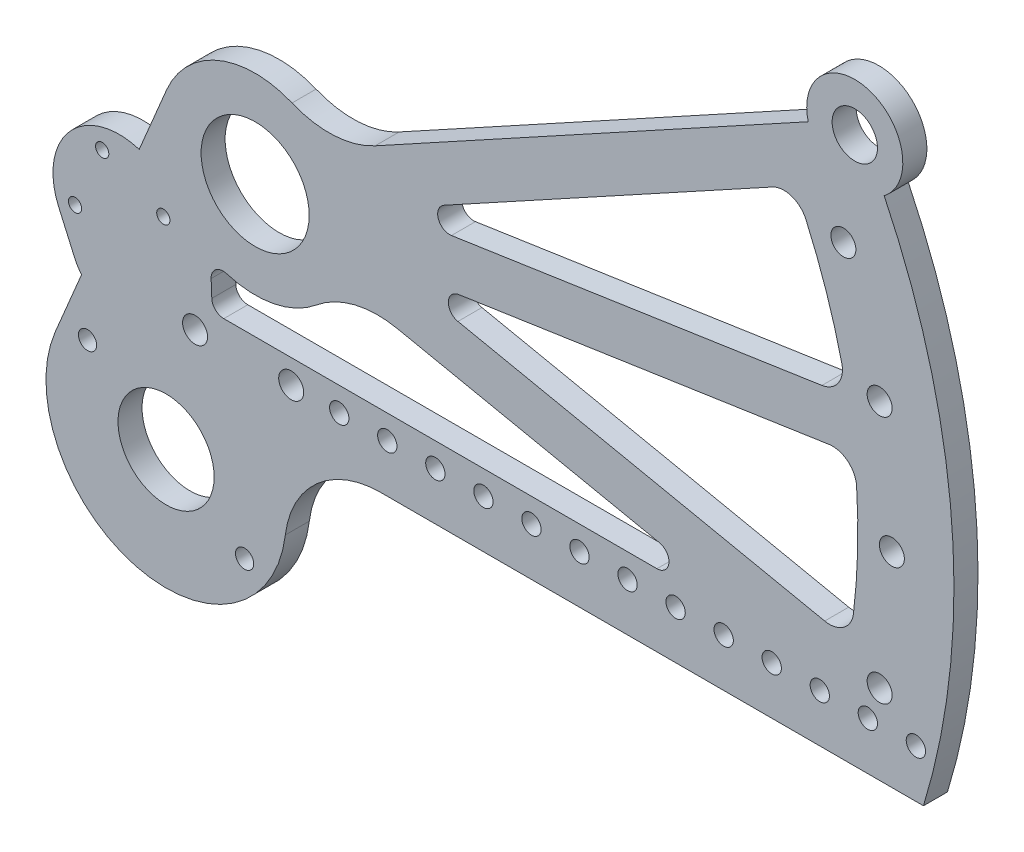
from build123d import *

# Parameters (mm, degrees)
SKETCH1_R           = 1.75
SKETCH1_R_2         = 3.302
SKETCH1_R_3         = 2.413
SKETCH1_R_4         = 12.7
SKETCH1_R_5         = 14.281149998
SKETCH1_R_6         = 2.5527
SKETCH1_R_7         = 5.9944
BOSS_EXTRUDE1_DEPTH = 6.35


with BuildPart() as part:
    # Sketch1 → Boss-Extrude1 (new body)
    with BuildSketch(Plane(origin=(0, 0, 0), x_dir=(-1, 0, 0), z_dir=(0, 0, -1))):
        with BuildLine():
            Line((-31.721738277, 24.629886735), (-146.170088384, 87.365400413))
            ThreePointArc((-146.170088384, 87.365400413), (-162.606044593, 102.518063532), (-166.242121917, 80.460801739))
            ThreePointArc((-166.242121917, 80.460801739), (-184.141380672, 14.224473287), (-176.626960261, -53.975))
            Line((-176.626960261, -53.975), (-33.194381935, -53.975))
            ThreePointArc((-33.194381935, -53.975), (-16.353189451, -60.360946363), (-7.980260895, -76.307737346))
            ThreePointArc((-7.980260895, -76.307737346), (31.676825474, -103.162616273), (52.812443226, -60.184078795))
            Line((52.812443226, -60.184078795), (45.859161931, -43.620642669))
            ThreePointArc((45.859161931, -43.620642669), (46.821980785, -42.387435085), (47.569931866, -41.013247954))
            Line((47.569931866, -41.013247954), (51.934565947, -31.139666326))
            ThreePointArc((51.934565947, -31.139666326), (48.962006062, -12.385946654), (30.645740354, -7.380696976))
            Line((30.645740354, -7.380696976), (23.420042255, 9.831664186))
            ThreePointArc((23.420042255, 9.831664186), (9.646239085, 23.497022608), (-9.756276385, 23.451547307))
            ThreePointArc((-9.756276385, 23.451547307), (-20.873181942, 21.53956394), (-31.721738277, 24.629886735))
        make_face()
        with Locations(Location((40.421189912, -12.399445261, 0), (0, 0, 180))):
            Circle(SKETCH1_R, mode=Mode.SUBTRACT)
        with Locations(Location((47.593474649, -28.556744901, 0), (0, 0, 180))):
            Circle(SKETCH1_R, mode=Mode.SUBTRACT)
        with Locations(Location((15.875, -41.275, 0), (0, 0, 180))):
            Circle(SKETCH1_R_2, mode=Mode.SUBTRACT)
        with Locations(Location((2.78154477, -87.114522117, 0), (0, 0, 180))):
            Circle(SKETCH1_R_3, mode=Mode.SUBTRACT)
        with Locations(Location((44.293236039, -57.832795939, 0), (0, 0, 180))):
            Circle(SKETCH1_R_3, mode=Mode.SUBTRACT)
        with Locations(Location((23.537390405, -72.473659028, 0), (0, 0, 180))):
            Circle(SKETCH1_R_4, mode=Mode.SUBTRACT)
        with Locations(Location((-9.525, -41.275, 0), (0, 0, 180))):
            Circle(SKETCH1_R_2, mode=Mode.SUBTRACT)
        with Locations(Location((-165.041643061, 32.828823937, 0), (0, 0, 180))):
            Circle(SKETCH1_R_2, mode=Mode.SUBTRACT)
        with Locations(Location((-165.041643061, -32.828823938, 0), (0, 0, 180))):
            Circle(SKETCH1_R_2, mode=Mode.SUBTRACT)
        with Locations(Location((-155.465828334, 64.396054582, 0), (0, 0, 180))):
            Circle(SKETCH1_R_2, mode=Mode.SUBTRACT)
        with Locations(Location((-168.275000002, -1e-09, 0), (0, 0, 180))):
            Circle(SKETCH1_R_2, mode=Mode.SUBTRACT)
        with Locations(Location((-2e-09, -1e-09, 0), (0, 0, 180))):
            Circle(SKETCH1_R_5, mode=Mode.SUBTRACT)
        with Locations(Location((-174.625, -41.275, 0), (0, 0, 180))):
            Circle(SKETCH1_R_6, mode=Mode.SUBTRACT)
        with Locations(Location((-161.925, -41.275, 0), (0, 0, 180))):
            Circle(SKETCH1_R_6, mode=Mode.SUBTRACT)
        with Locations(Location((-149.225, -41.275, 0), (0, 0, 180))):
            Circle(SKETCH1_R_6, mode=Mode.SUBTRACT)
        with Locations(Location((-136.525, -41.275, 0), (0, 0, 180))):
            Circle(SKETCH1_R_6, mode=Mode.SUBTRACT)
        with Locations(Location((-123.825, -41.275, 0), (0, 0, 180))):
            Circle(SKETCH1_R_6, mode=Mode.SUBTRACT)
        with Locations(Location((-111.125, -41.275, 0), (0, 0, 180))):
            Circle(SKETCH1_R_6, mode=Mode.SUBTRACT)
        with Locations(Location((-98.425, -41.275, 0), (0, 0, 180))):
            Circle(SKETCH1_R_6, mode=Mode.SUBTRACT)
        with Locations(Location((-73.025, -41.275, 0), (0, 0, 180))):
            Circle(SKETCH1_R_6, mode=Mode.SUBTRACT)
        with Locations(Location((-85.725, -41.275, 0), (0, 0, 180))):
            Circle(SKETCH1_R_6, mode=Mode.SUBTRACT)
        with Locations(Location((-60.325, -41.275, 0), (0, 0, 180))):
            Circle(SKETCH1_R_6, mode=Mode.SUBTRACT)
        with Locations(Location((-47.625, -41.275, 0), (0, 0, 180))):
            Circle(SKETCH1_R_6, mode=Mode.SUBTRACT)
        with Locations(Location((-34.925, -41.275, 0), (0, 0, 180))):
            Circle(SKETCH1_R_6, mode=Mode.SUBTRACT)
        with Locations(Location((-22.225, -41.275, 0), (0, 0, 180))):
            Circle(SKETCH1_R_6, mode=Mode.SUBTRACT)
        with Locations(Location((24.263890272, -19.571729998, 0), (0, 0, 180))):
            Circle(SKETCH1_R, mode=Mode.SUBTRACT)
        with Locations(Location((-158.474943349, 90.50873372, 0), (0, 0, 180))):
            Circle(SKETCH1_R_7, mode=Mode.SUBTRACT)
        with BuildLine():
            Line((-136.7018524, 67.692461879), (-49.888483047, 20.105219989))
            ThreePointArc((-49.888483047, 20.105219989), (-48.40578749, 16.307419992), (-51.884293307, 14.180998537))
            Line((-51.884293307, 14.180998537), (-149.795684871, 28.825659386))
            ThreePointArc((-149.795684871, 28.825659386), (-154.113819123, 31.54467252), (-155.036811216, 36.563377676))
            ThreePointArc((-155.036811216, 36.563377676), (-150.953895829, 50.854840016), (-145.556679438, 64.703527647))
            ThreePointArc((-145.556679438, 64.703527647), (-141.785005521, 68.14064733), (-136.7018524, 67.692461879))
        make_face(mode=Mode.SUBTRACT)
        with BuildLine():
            Line((-106.835310381, -28.641149755), (-37.540069632, -14.270359918))
            ThreePointArc((-37.540069632, -14.270359918), (-26.262071615, -14.489518064), (-16.191119842, -19.57058094))
            ThreePointArc((-16.191119842, -19.57058094), (-4.929611011, -24.917041063), (7.519343103, -24.261481391))
            ThreePointArc((7.519343103, -24.261481391), (10.392776221, -24.775805222), (11.631809956, -27.41889854))
            Line((11.631809956, -27.41889854), (11.456624353, -31.874731975))
            ThreePointArc((11.456624353, -31.874731975), (10.484598164, -34.038738629), (8.284075388, -34.925))
            Line((8.284075388, -34.925), (-106.190581637, -34.925))
            ThreePointArc((-106.190581637, -34.925), (-109.349000904, -32.074056686), (-106.835310381, -28.641149755))
        make_face(mode=Mode.SUBTRACT)
        with BuildLine():
            Line((-151.674333159, 16.265377518), (-53.762941599, 1.62071667))
            ThreePointArc((-53.762941599, 1.62071667), (-51.058848917, -1.430439454), (-53.587874927, -4.628204042))
            Line((-53.587874927, -4.628204042), (-150.525780255, -24.731666411))
            ThreePointArc((-150.525780255, -24.731666411), (-155.517613032, -23.672930664), (-158.118539501, -19.282657626))
            ThreePointArc((-158.118539501, -19.282657626), (-159.227492405, -4.460838665), (-158.95010909, 10.399819206))
            ThreePointArc((-158.95010909, 10.399819206), (-156.599060705, 14.928824322), (-151.674333159, 16.265377518))
        make_face(mode=Mode.SUBTRACT)
    extrude(amount=-BOSS_EXTRUDE1_DEPTH)


solid = part.part
